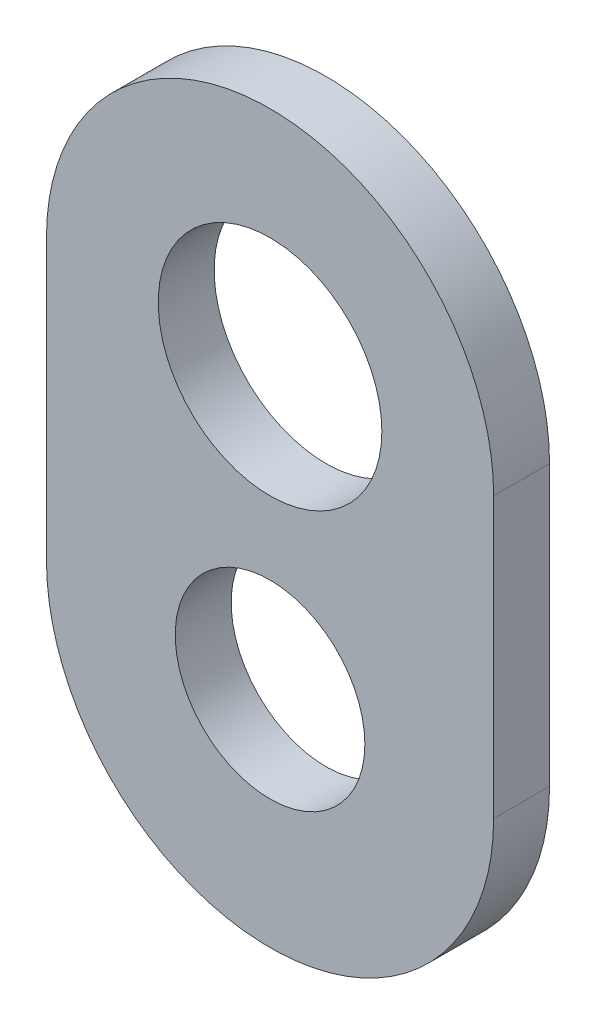
from build123d import *

# Parameters (mm, degrees)
SKETCH1_R           = 12.7
SKETCH1_R_2         = 10.7696
BOSS_EXTRUDE1_DEPTH = 6.35


with BuildPart() as part:
    # Sketch1 → Boss-Extrude1 (new body)
    with BuildSketch(Plane.XY):
        with BuildLine():
            Line((-25.4, 0), (-25.4, -31.75))
            ThreePointArc((-25.4, -31.75), (0, -57.15), (25.4, -31.75))
            Line((25.4, -31.75), (25.4, 0))
            ThreePointArc((25.4, 0), (0, 25.4), (-25.4, 0))
        make_face()
        Circle(SKETCH1_R, mode=Mode.SUBTRACT)
        with Locations((0, -31.75)):
            Circle(SKETCH1_R_2, mode=Mode.SUBTRACT)
    extrude(amount=BOSS_EXTRUDE1_DEPTH)


solid = part.part
